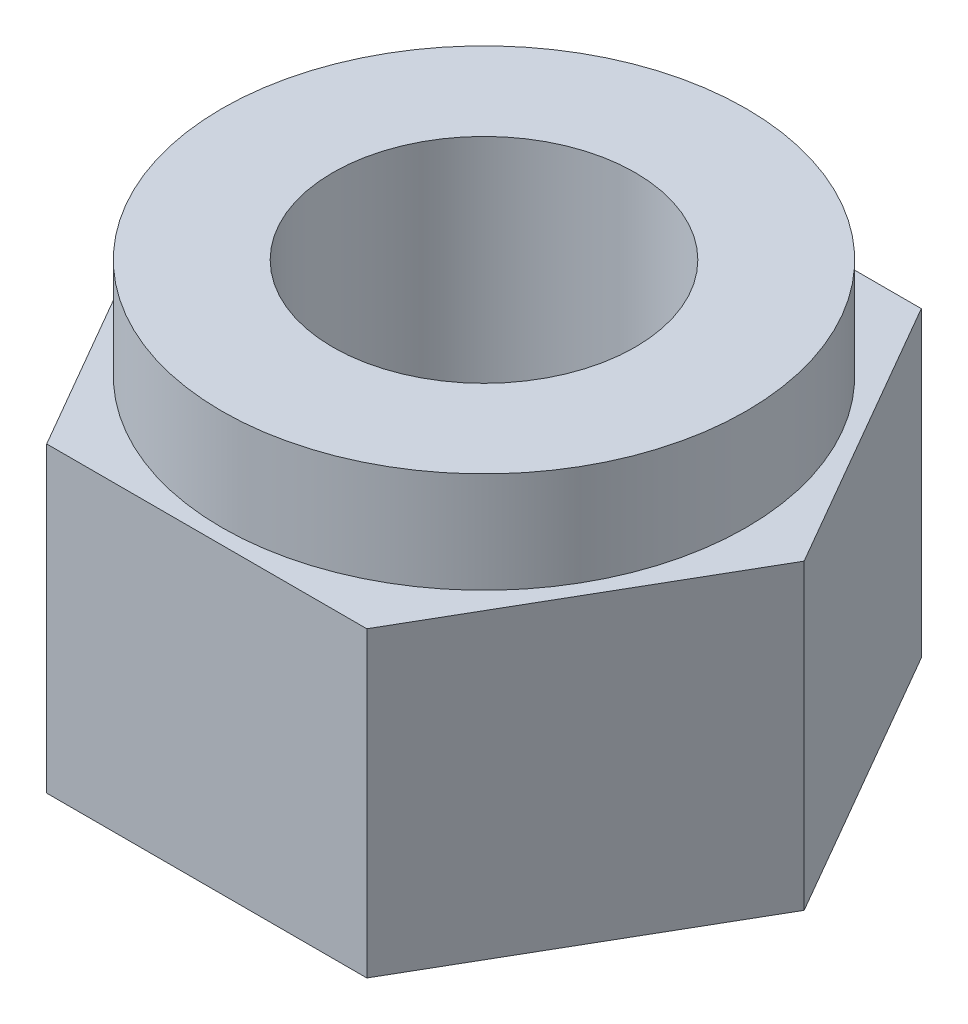
from build123d import *

# Parameters (mm, degrees)
BOSS_EXTRU_1_DEPTH      = 3
BOSS_EXTRU_2_START      = 3
ESQUISSE2_R             = 2.6
ESQUISSE2_R_2           = 1.5
BOSS_EXTRU_2_DEPTH      = 1
ESQUISSE3_R             = 1.5
ENL_V_MAT_EXTRU_1_DEPTH = 6.800502852


with BuildPart() as part:
    # Esquisse1 → Boss.-Extru.1 (new body)
    with BuildSketch(Plane(origin=(0, 0, 0), x_dir=(1, 0, 0), z_dir=(0, 1, 0))):
        Polygon((3.175426481, 0), (1.58771324, 2.75), (-1.58771324, 2.75), (-3.175426481, 0), (-1.58771324, -2.75), (1.58771324, -2.75), align=None)
    extrude(amount=BOSS_EXTRU_1_DEPTH)

    # Esquisse2 → Boss.-Extru.2 (add)
    with BuildSketch(Plane(origin=(0, 0, 0), x_dir=(1, 0, 0), z_dir=(0, 1, 0)).offset(BOSS_EXTRU_2_START)):
        with Locations(Location((0, 0, 0), (0, 0, 270))):
            Circle(ESQUISSE2_R)
        with Locations(Location((0, 0, 0), (0, 0, 270))):
            Circle(ESQUISSE2_R_2, mode=Mode.SUBTRACT)
    extrude(amount=BOSS_EXTRU_2_DEPTH)

    # Esquisse3 → Enlèv. mat.-Extru.1 (cut, through all)
    with BuildSketch(Plane(origin=(0, 0, 0), x_dir=(1, 0, 0), z_dir=(0, 1, 0))):
        with Locations(Location((0, 0, 0), (0, 0, 270))):
            Circle(ESQUISSE3_R)
    extrude(amount=ENL_V_MAT_EXTRU_1_DEPTH, mode=Mode.SUBTRACT)


solid = part.part
